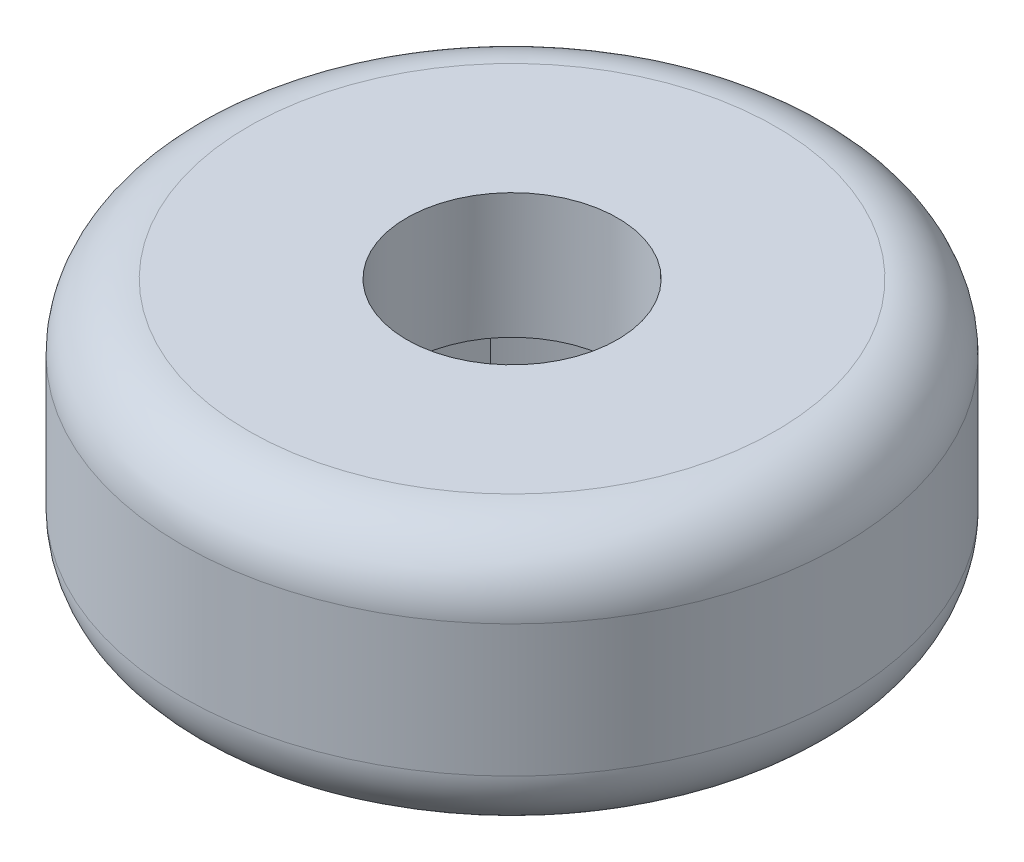
from build123d import *

# Parameters (mm, degrees)
SKETCH_1_R          = 5
SKETCH_1_R_2        = 3.1
SKETCH_1_W          = 4.2
SKETCH_1_H          = 4.5607017
EXTRUDE_1_DEPTH     = 4
SKETCH_2_W          = 4.7
SKETCH_2_H          = 4.043513324
CUT_EXTRUDE_1_DEPTH = 2.1
SKETCH_3_R          = 1.6
CUT_EXTRUDE_2_DEPTH = 3
FILLET_1_R          = 1


with BuildPart() as part:
    # ｽｹｯﾁ1 → ﾎﾞｽ - 押し出し1 (new body)
    # profile 1 of 6: a face of its own
    with BuildSketch(Plane(origin=(0, 0, 0), x_dir=(1, 0, 0), z_dir=(0, 1, 0))):
        with Locations(Location((-75.085298438, 13.647723363, 0), (0, 0, 270))):
            Circle(SKETCH_1_R)
        with Locations((-75.085298438, 13.647723363)):
            Circle(SKETCH_1_R_2, mode=Mode.SUBTRACT)
    # profile 2 of 6: a face of its own
    with BuildSketch(Plane(origin=(0, 0, 0), x_dir=(1, 0, 0), z_dir=(0, 1, 0))):
        with BuildLine():
            ThreePointArc((-71.985298438, 13.647723363), (-72.246284525, 14.892713323), (-72.985298438, 15.928074213))
            Line((-72.985298438, 15.928074213), (-72.985298438, 11.367372513))
            ThreePointArc((-72.985298438, 11.367372513), (-72.246284525, 12.402733403), (-71.985298438, 13.647723363))
        make_face()
    # profile 3 of 6: a face of its own
    with BuildSketch(Plane(origin=(0, 0, 0), x_dir=(1, 0, 0), z_dir=(0, 1, 0))):
        with BuildLine():
            Line((-77.185298438, 11.367372513), (-77.185298438, 15.928074213))
            ThreePointArc((-77.185298438, 15.928074213), (-78.185298438, 13.647723363), (-77.185298438, 11.367372513))
        make_face()
    # profile 4 of 6: a face of its own
    with BuildSketch(Plane(origin=(0, 0, 0), x_dir=(1, 0, 0), z_dir=(0, 1, 0))):
        with BuildLine():
            ThreePointArc((-72.985298438, 15.928074213), (-75.085298438, 16.747723363), (-77.185298438, 15.928074213))
            Line((-77.185298438, 15.928074213), (-72.985298438, 15.928074213))
        make_face()
    # profile 5 of 6: a face of its own
    with BuildSketch(Plane(origin=(0, 0, 0), x_dir=(1, 0, 0), z_dir=(0, 1, 0))):
        with Locations((-75.085298438, 13.647723363)):
            Rectangle(SKETCH_1_W, SKETCH_1_H)
    # profile 6 of 6: a face of its own
    with BuildSketch(Plane(origin=(0, 0, 0), x_dir=(1, 0, 0), z_dir=(0, 1, 0))):
        with BuildLine():
            Line((-72.985298438, 11.367372513), (-77.185298438, 11.367372513))
            ThreePointArc((-77.185298438, 11.367372513), (-75.085298438, 10.547723363), (-72.985298438, 11.367372513))
        make_face()
    extrude(amount=EXTRUDE_1_DEPTH)

    # ｽｹｯﾁ2 → ｶｯﾄ - 押し出し1 (cut)
    with BuildSketch(Plane.XZ):
        with Locations((-75.085298438, -13.647723363)):
            Rectangle(SKETCH_2_W, SKETCH_2_H)
        with BuildLine():
            ThreePointArc((-72.735298438, -11.625966701), (-75.085298438, -10.547723363), (-77.435298438, -11.625966701))
            Line((-77.435298438, -11.625966701), (-72.735298438, -11.625966701))
        make_face()
        with BuildLine():
            Line((-72.735298438, -15.669480025), (-77.435298438, -15.669480025))
            ThreePointArc((-77.435298438, -15.669480025), (-75.085298438, -16.747723363), (-72.735298438, -15.669480025))
        make_face()
    extrude(amount=-CUT_EXTRUDE_1_DEPTH, mode=Mode.SUBTRACT)

    # ｽｹｯﾁ3 → ｶｯﾄ - 押し出し2 (cut)
    with BuildSketch(Plane(origin=(0, 4, 0), x_dir=(1, 0, 0), z_dir=(0, 1, 0))):
        with Locations(Location((-75.085298438, 13.647723363, 0), (0, 0, 270))):
            Circle(SKETCH_3_R)
    extrude(amount=-CUT_EXTRUDE_2_DEPTH, mode=Mode.SUBTRACT)

    # ﾌｨﾚｯﾄ1
    fillet_1_edges = [part.edges().sort_by_distance(p)[0] for p in [
        (-75.085298438, 0, -18.647723363),
        (-75.085298438, 4, -18.647723363),
    ]]
    fillet(fillet_1_edges, radius=FILLET_1_R)


solid = part.part
